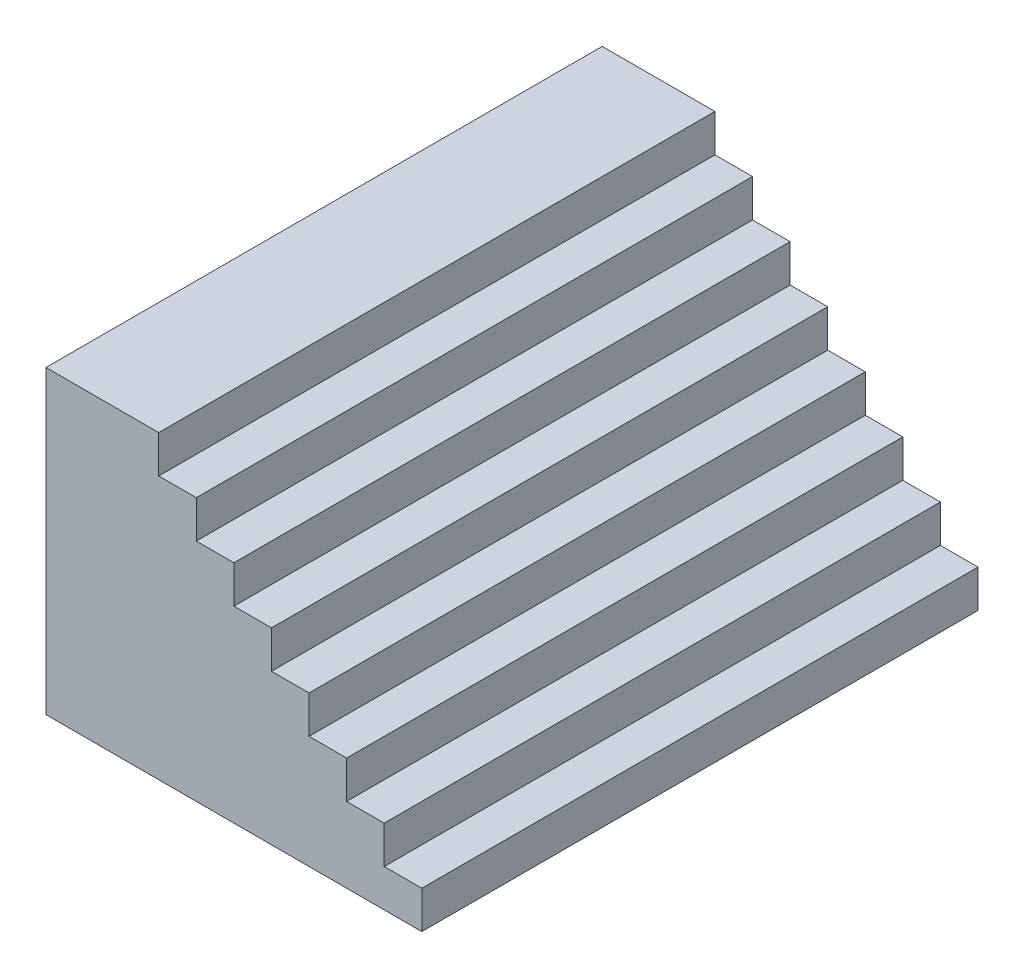
from build123d import *

# Parameters (mm, degrees)
SKETCH1_W           = 3700
SKETCH1_H           = 2000
BOSS_EXTRUDE1_DEPTH = 2500
CUT_EXTRUDE1_DEPTH  = 5000


with BuildPart() as part:
    # Sketch1 → Boss-Extrude1 (new body)
    with BuildSketch(Plane(origin=(0, 0, 0), x_dir=(0, 0, -1), z_dir=(1, 0, 0))):
        Rectangle(SKETCH1_W, SKETCH1_H)
    extrude(amount=BOSS_EXTRUDE1_DEPTH)

    # Sketch4 → Cut-Extrude1 (cut)
    with BuildSketch(Plane.XY.offset(1850)):
        Polygon((2500, -750), (2250, -750), (2250, -500), (2000, -500), (2000, -250), (1750, -250), (1750, 0), (1500, 0), (1500, 250), (1250, 250), (1250, 500), (1000, 500), (1000, 750), (750, 750), (750, 1000), (2500, 1000), align=None)
    extrude(amount=-CUT_EXTRUDE1_DEPTH, mode=Mode.SUBTRACT)


solid = part.part
